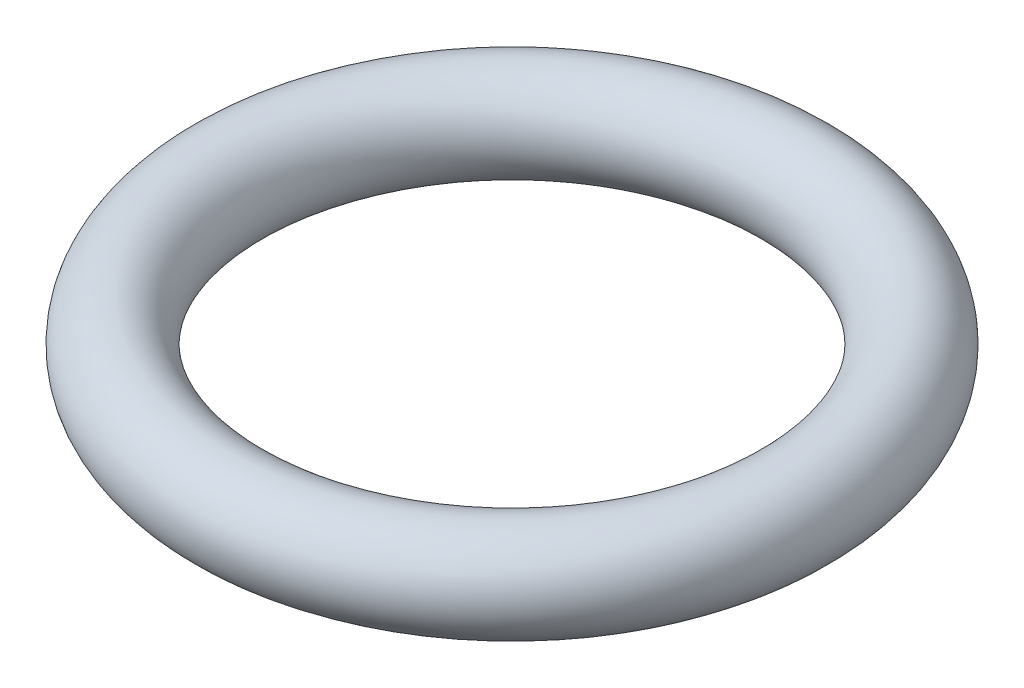
from build123d import *

# Parameters (mm, degrees)
SKETCH1_R          = 25.4
CUT_EXTRUDE1_START = -24.13
SKETCH3_R          = 237.337389824
CUT_EXTRUDE1_DEPTH = 229.596809176


with BuildPart() as part:
    # Sketch1 → Revolve1 (revolve)
    with BuildSketch(Plane.XY, mode=Mode.PRIVATE) as revolve1_sk:
        with Locations((152.4, 0)):
            Circle(SKETCH1_R)
    revolve(revolve1_sk.sketch.rotate(Axis((0, 0, 0), (0, 1, 0)), 90), axis=Axis((0, 0, 0), (0, 1, 0)))

    # Sketch3 → Cut-Extrude1 (cut, through all)
    with BuildSketch(Plane(origin=(0, 0, 0), x_dir=(1, 0, 0), z_dir=(0, 1, 0)).offset(CUT_EXTRUDE1_START)):
        Circle(SKETCH3_R)
    extrude(amount=-CUT_EXTRUDE1_DEPTH, mode=Mode.SUBTRACT)


solid = part.part
